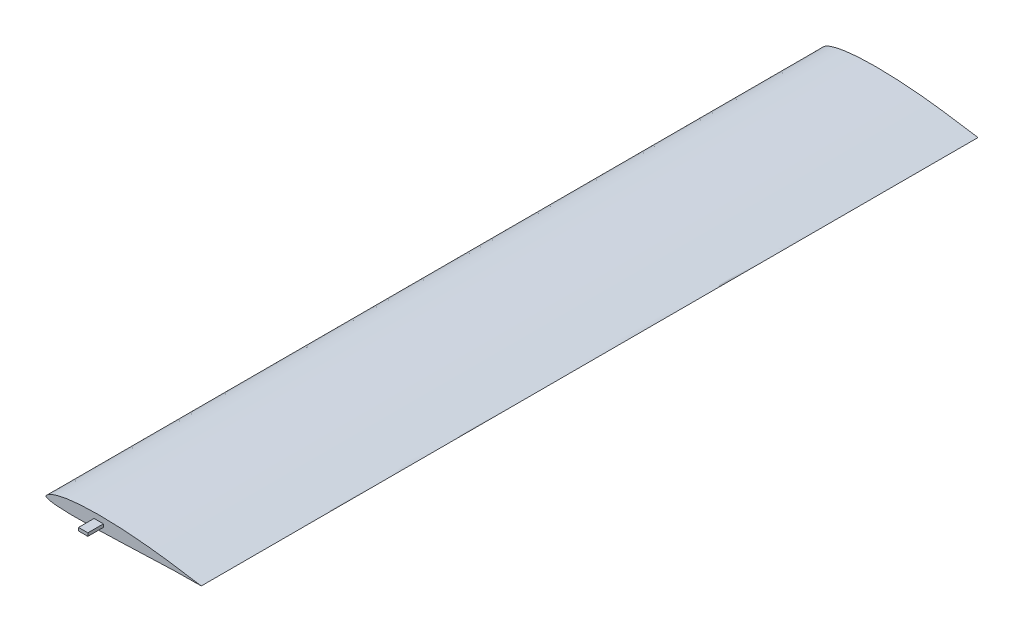
from build123d import *

# Parameters (mm, degrees)
BOSS_EXTRUDE1_DEPTH = 250
SKETCH2_W           = 3
SKETCH2_H           = 1
BOSS_EXTRUDE2_DEPTH = 5


with BuildPart() as part:
    # Sketch1 → Boss-Extrude1 (new body)
    with BuildSketch(Plane.XY):
        with BuildLine():
            add(Edge.make_bspline(
                [(50, 0), (50.000127321, 0.002422792), (49.652184009, 0.032958621), (49.301097208, 0.083188509), (48.459274004, 0.194453497), (47.441479646, 0.349875411), (46.133776608, 0.554864154), (44.615485046, 0.799310742), (42.892312753, 1.07508556), (40.995754148, 1.370980431), (38.94771753, 1.674669482), (36.770322955, 1.971115616), (34.483839246, 2.249761345), (32.108990986, 2.504840128), (29.66860858, 2.732239843), (27.188921164, 2.931782342), (24.697141476, 3.099622867), (22.218817139, 3.225155168), (19.778447637, 3.304800695), (17.399570259, 3.338767304), (15.104318179, 3.320960878), (12.913773107, 3.249229887), (10.847546414, 3.129619148), (8.924509706, 2.959577327), (7.161287843, 2.740428866), (5.571517506, 2.476714534), (4.16707883, 2.17390075), (2.957626952, 1.83762559), (1.950465142, 1.477263452), (1.148816473, 1.103045788), (0.558729346, 0.731078994), (0.228075961, 0.436603357), (0.089992171, 0.239435058), (0.040814575, 0.152213957), (0.010449843, 0.073827097), (-0.001543212, 0.012029906), (0.000871812, -0.036665913), (0.024720092, -0.080378542), (0.069417909, -0.130458815), (0.141050471, -0.188547481), (0.314418628, -0.296228741), (0.700511343, -0.453609623), (1.378093814, -0.628171654), (2.337457247, -0.787734756), (3.538967448, -0.918209355), (4.974167945, -1.015410816), (6.631209203, -1.07934352), (8.495610444, -1.110654464), (10.549669024, -1.111991231), (12.77276295, -1.086785548), (15.141440561, -1.038931402), (17.629849017, -0.972256842), (20.210338001, -0.890564709), (22.853820047, -0.797649566), (25.530288492, -0.69692322), (28.20906111, -0.592479053), (30.859040964, -0.487645246), (33.448999851, -0.386619732), (35.947841946, -0.292376734), (38.325016638, -0.208048773), (40.551004266, -0.135849855), (42.596395244, -0.078478019), (44.436055182, -0.036461301), (46.037752375, -0.009148581), (47.398981695, 0.004310281), (48.444054367, 0.00956179), (49.297247507, 0.004211274), (49.651501088, 0.008982102), (49.999872564, -0.00242498), (50, 0)],
                knots=[0, 0, 0, 0, 0.00163101, 0.006435235, 0.014220669, 0.024765625, 0.037826727, 0.053149348, 0.070473504, 0.089535694, 0.110075428, 0.131859875, 0.154692567, 0.178371256, 0.202679512, 0.227363961, 0.252132687, 0.276728351, 0.300939435, 0.324527111, 0.347267377, 0.368991726, 0.389507471, 0.40862838, 0.426224009, 0.442178728, 0.456395551, 0.468805124, 0.479372318, 0.488085518, 0.494967924, 0.50003381, 0.501035663, 0.50209449, 0.502996978, 0.50351288, 0.503955826, 0.504408894, 0.504955423, 0.505942626, 0.507129614, 0.510997735, 0.518231919, 0.527845532, 0.539808758, 0.554055915, 0.570489592, 0.588973674, 0.609342058, 0.631392897, 0.654894034, 0.679589725, 0.705203145, 0.731446604, 0.758020282, 0.784619628, 0.810935624, 0.836656653, 0.861473352, 0.885081475, 0.907187944, 0.927507338, 0.945765257, 0.961711874, 0.975121793, 0.985796266, 0.993581185, 0.998367518, 1, 1, 1, 1], degree=3))
        make_face()
    extrude(amount=BOSS_EXTRUDE1_DEPTH)

    # Sketch2 → Boss-Extrude2 (add)
    with BuildSketch(Plane.XY.offset(250)):
        with Locations((16.973, 1.049371014)):
            Rectangle(SKETCH2_W, SKETCH2_H)
    extrude(amount=BOSS_EXTRUDE2_DEPTH)


solid = part.part
